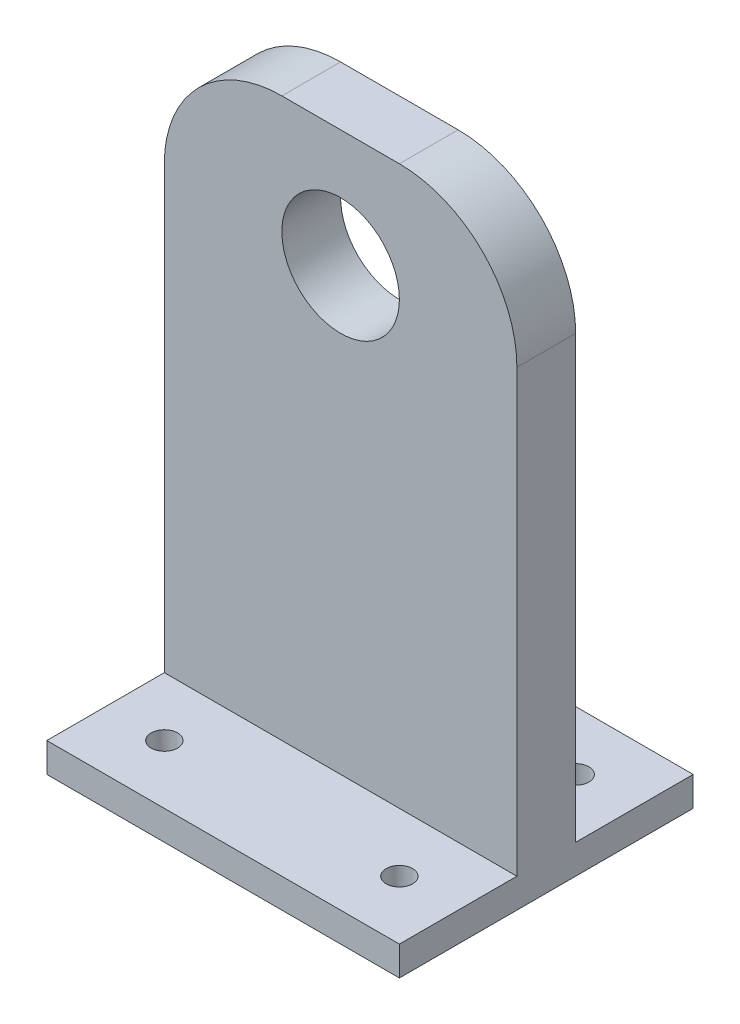
from build123d import *

# Parameters (mm, degrees)
SKETCH_1_W          = 60
SKETCH_1_H          = 100
SKETCH_1_R          = 10
EXTRUDE_1_DEPTH     = 10
SKETCH_2_R          = 10
EXTRUDE_2_DEPTH     = 2
FILLET_1_R          = 20
SKETCH_3_W          = 60
SKETCH_3_H          = 50
EXTRUDE_3_DEPTH     = 5
SKETCH_4_R          = 2.25
CUT_EXTRUDE_1_DEPTH = 105.043260233
CUT_EXTRUDE_START   = -10
SKETCH_5_R          = 10
CUT_EXTRUDE_2_DEPTH = 10


with BuildPart() as part:
    # 草图1 → 凸台-拉伸1 (new body)
    with BuildSketch(Plane.XY):
        with Locations((0, 50)):
            Rectangle(SKETCH_1_W, SKETCH_1_H)
        with Locations((0, 80)):
            Circle(SKETCH_1_R, mode=Mode.SUBTRACT)
    extrude(amount=EXTRUDE_1_DEPTH)

    # 草图2 → 凸台-拉伸2 (add)
    with BuildSketch(Plane(origin=(0, 0, 0), x_dir=(-1, 0, 0), z_dir=(0, 0, -1))):
        with Locations((0, 80)):
            Circle(SKETCH_2_R)
    extrude(amount=-EXTRUDE_2_DEPTH)

    # 圆角1
    fillet_1_edges = [part.edges().sort_by_distance(p)[0] for p in [
        (-30, 100, 5),
        (30, 100, 5),
    ]]
    fillet(fillet_1_edges, radius=FILLET_1_R)

    # 草图3 → 凸台-拉伸3 (add)
    with BuildSketch(Plane.XZ):
        with Locations((0, 5)):
            Rectangle(SKETCH_3_W, SKETCH_3_H)
    extrude(amount=-EXTRUDE_3_DEPTH)

    # 草图4 → 切除-拉伸1 (cut, through all)
    with BuildSketch(Plane(origin=(0, 5, 0), x_dir=(1, 0, 0), z_dir=(0, 1, 0))):
        with Locations(Location((-20, 10, 0), (0, 0, 270))):
            Circle(SKETCH_4_R)
        with Locations(Location((20, 10, 0), (0, 0, 270))):
            Circle(SKETCH_4_R)
        with Locations(Location((-20, -20, 0), (0, 0, 270))):
            Circle(SKETCH_4_R)
        with Locations(Location((20, -20, 0), (0, 0, 270))):
            Circle(SKETCH_4_R)
    extrude(amount=-CUT_EXTRUDE_1_DEPTH, mode=Mode.SUBTRACT)

    # 草图5 → 切除-拉伸2 (cut)
    with BuildSketch(Plane.XY.offset(2).offset(CUT_EXTRUDE_START)):
        with Locations((0, 80)):
            Circle(SKETCH_5_R)
    extrude(amount=CUT_EXTRUDE_2_DEPTH, mode=Mode.SUBTRACT)


solid = part.part
